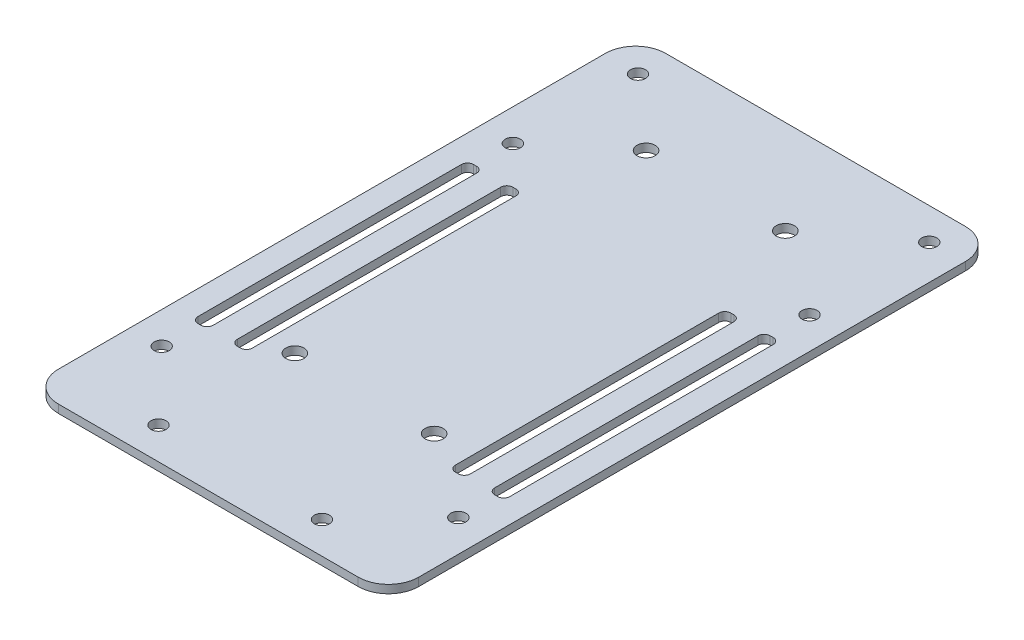
from build123d import *

# Parameters (mm, degrees)
SKETCH2_W           = 59.5
SKETCH2_H           = 100.3
SKETCH2_R           = 1.25
SKETCH2_R_2         = 1.5
BOSS_EXTRUDE1_DEPTH = 1.35
FILLET1_R           = 5
CUT_EXTRUDE1_REACH  = 64.853
SKETCH3_W           = 2.5
SKETCH3_H           = 45.5
FILLET2_R           = 1


with BuildPart() as part:
    # Sketch2 → Boss-Extrude1 (new body)
    with BuildSketch(Plane(origin=(0, 0, 0), x_dir=(1, 0, 0), z_dir=(0, 1, 0))):
        with Locations((0, 5.2)):
            Rectangle(SKETCH2_W, SKETCH2_H)
        with Locations(Location((-24.5, 29.84, 0), (0, 0, 90))):
            Circle(SKETCH2_R, mode=Mode.SUBTRACT)
        with Locations(Location((-24.085, 50.1, 0), (0, 0, 90))):
            Circle(SKETCH2_R, mode=Mode.SUBTRACT)
        with Locations(Location((24.015, 50.1, 0), (0, 0, 90))):
            Circle(SKETCH2_R, mode=Mode.SUBTRACT)
        with Locations(Location((24.5, 29.84, 0), (0, 0, 90))):
            Circle(SKETCH2_R, mode=Mode.SUBTRACT)
        with Locations(Location((24.5, -28.16, 0), (0, 0, 90))):
            Circle(SKETCH2_R, mode=Mode.SUBTRACT)
        with Locations(Location((-24.5, -28.16, 0), (0, 0, 90))):
            Circle(SKETCH2_R, mode=Mode.SUBTRACT)
        with Locations(Location((-13.485, -39.7, 0), (0, 0, 90))):
            Circle(SKETCH2_R, mode=Mode.SUBTRACT)
        with Locations(Location((13.515, -39.7, 0), (0, 0, 90))):
            Circle(SKETCH2_R, mode=Mode.SUBTRACT)
        with Locations(Location((-12.5, -18.16, 0), (0, 0, 90))):
            Circle(SKETCH2_R_2, mode=Mode.SUBTRACT)
        with Locations(Location((10.5, -18.16, 0), (0, 0, 90))):
            Circle(SKETCH2_R_2, mode=Mode.SUBTRACT)
        with Locations(Location((10.5, 39.84, 0), (0, 0, 90))):
            Circle(SKETCH2_R_2, mode=Mode.SUBTRACT)
        with Locations(Location((-12.5, 39.84, 0), (0, 0, 90))):
            Circle(SKETCH2_R_2, mode=Mode.SUBTRACT)
    extrude(amount=BOSS_EXTRUDE1_DEPTH)

    # Fillet1
    fillet1_edges = [part.edges().sort_by_distance(p)[0] for p in [
        (29.75, 0.675, -55.35),
        (29.75, 0.675, 44.95),
        (-29.75, 0.675, 44.95),
        (-29.75, 0.675, -55.35),
    ]]
    fillet(fillet1_edges, radius=FILLET1_R)

    # Sketch3 → Cut-Extrude1 (cut, up to next)
    with BuildSketch(Plane(origin=(0, 1.35, 0), x_dir=(1, 0, 0), z_dir=(0, 1, 0)), mode=Mode.PRIVATE) as cut_extrude1_sk1:
        with Locations((18, 0.84)):
            Rectangle(SKETCH3_W, SKETCH3_H)
    cut_extrude1_tool1 = extrude(cut_extrude1_sk1.sketch, amount=-CUT_EXTRUDE1_REACH, mode=Mode.PRIVATE) & part.part
    # Sketch3 → Cut-Extrude1 (cut, up to next)
    with BuildSketch(Plane(origin=(0, 1.35, 0), x_dir=(1, 0, 0), z_dir=(0, 1, 0)), mode=Mode.PRIVATE) as cut_extrude1_sk2:
        with Locations((-24.5, 0.84)):
            Rectangle(SKETCH3_W, SKETCH3_H)
    cut_extrude1_tool2 = extrude(cut_extrude1_sk2.sketch, amount=-CUT_EXTRUDE1_REACH, mode=Mode.PRIVATE) & part.part
    # Sketch3 → Cut-Extrude1 (cut, up to next)
    with BuildSketch(Plane(origin=(0, 1.35, 0), x_dir=(1, 0, 0), z_dir=(0, 1, 0)), mode=Mode.PRIVATE) as cut_extrude1_sk3:
        with Locations((-18, 0.84)):
            Rectangle(SKETCH3_W, SKETCH3_H)
    cut_extrude1_tool3 = extrude(cut_extrude1_sk3.sketch, amount=-CUT_EXTRUDE1_REACH, mode=Mode.PRIVATE) & part.part
    # Sketch3 → Cut-Extrude1 (cut, up to next)
    with BuildSketch(Plane(origin=(0, 1.35, 0), x_dir=(1, 0, 0), z_dir=(0, 1, 0)), mode=Mode.PRIVATE) as cut_extrude1_sk4:
        with Locations((24.5, 0.84)):
            Rectangle(SKETCH3_W, SKETCH3_H)
    cut_extrude1_tool4 = extrude(cut_extrude1_sk4.sketch, amount=-CUT_EXTRUDE1_REACH, mode=Mode.PRIVATE) & part.part
    add(cut_extrude1_tool1.solids().sort_by_distance((18, 1.35, -0.84))[0], mode=Mode.SUBTRACT)
    add(cut_extrude1_tool2.solids().sort_by_distance((-24.5, 1.35, -0.84))[0], mode=Mode.SUBTRACT)
    add(cut_extrude1_tool3.solids().sort_by_distance((-18, 1.35, -0.84))[0], mode=Mode.SUBTRACT)
    add(cut_extrude1_tool4.solids().sort_by_distance((24.5, 1.35, -0.84))[0], mode=Mode.SUBTRACT)

    # Fillet2
    fillet2_edges = [part.edges().sort_by_distance(p)[0] for p in [
        (-23.25, 0.675, -23.59),
        (-23.25, 0.675, 21.91),
        (-25.75, 0.675, 21.91),
        (-25.75, 0.675, -23.59),
        (-16.75, 0.675, -23.59),
        (-16.75, 0.675, 21.91),
        (-19.25, 0.675, 21.91),
        (-19.25, 0.675, -23.59),
        (19.25, 0.675, -23.59),
        (19.25, 0.675, 21.91),
        (16.75, 0.675, 21.91),
        (16.75, 0.675, -23.59),
        (25.75, 0.675, -23.59),
        (25.75, 0.675, 21.91),
        (23.25, 0.675, 21.91),
        (23.25, 0.675, -23.59),
    ]]
    fillet(fillet2_edges, radius=FILLET2_R)


solid = part.part
